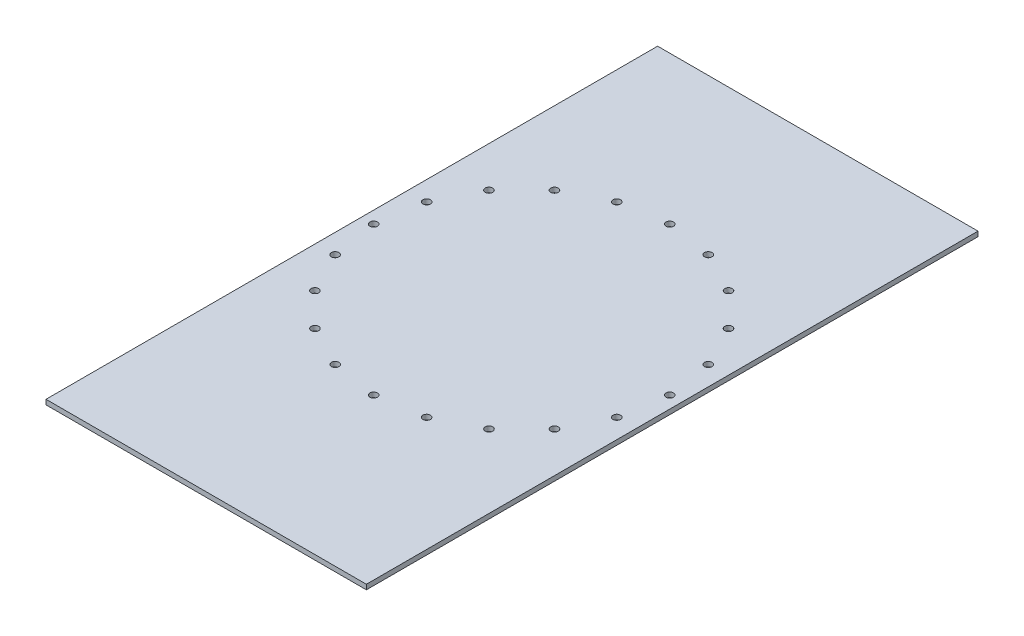
from build123d import *

# Parameters (mm, degrees)
ESQUISSE1_W             = 660
ESQUISSE1_H             = 1260
BOSS_EXTRU_1_DEPTH      = 10
ESQUISSE2_R             = 7.75
ENL_V_MAT_EXTRU_1_DEPTH = 10


with BuildPart() as part:
    # Esquisse1 → Boss.-Extru.1 (new body)
    with BuildSketch(Plane(origin=(0, 0, 0), x_dir=(1, 0, 0), z_dir=(0, 1, 0))):
        with Locations((330, 630)):
            Rectangle(ESQUISSE1_W, ESQUISSE1_H)
    extrude(amount=BOSS_EXTRU_1_DEPTH)

    # Esquisse2 → Enlèv. mat.-Extru.1 (cut)
    with BuildSketch(Plane(origin=(0, 10, 0), x_dir=(1, 0, 0), z_dir=(0, 1, 0))):
        with Locations(Location((25, 650, 0), (0, 0, 270))):
            Circle(ESQUISSE2_R)
        with Locations(Location((39.92776253, 744.250183284, 0), (0, 0, 270))):
            Circle(ESQUISSE2_R)
        with Locations(Location((83.249816716, 829.274501949, 0), (0, 0, 270))):
            Circle(ESQUISSE2_R)
        with Locations(Location((150.725498051, 896.750183284, 0), (0, 0, 270))):
            Circle(ESQUISSE2_R)
        with Locations(Location((235.749816716, 940.07223747, 0), (0, 0, 270))):
            Circle(ESQUISSE2_R)
        with Locations(Location((330, 955, 0), (0, 0, 270))):
            Circle(ESQUISSE2_R)
        with Locations(Location((424.250183284, 940.07223747, 0), (0, 0, 270))):
            Circle(ESQUISSE2_R)
        with Locations(Location((509.274501949, 896.750183284, 0), (0, 0, 270))):
            Circle(ESQUISSE2_R)
        with Locations(Location((576.750183284, 829.274501949, 0), (0, 0, 270))):
            Circle(ESQUISSE2_R)
        with Locations(Location((620.07223747, 744.250183284, 0), (0, 0, 270))):
            Circle(ESQUISSE2_R)
        with Locations(Location((635, 650, 0), (0, 0, 270))):
            Circle(ESQUISSE2_R)
        with Locations(Location((620.07223747, 555.749816716, 0), (0, 0, 270))):
            Circle(ESQUISSE2_R)
        with Locations(Location((576.750183284, 470.725498051, 0), (0, 0, 270))):
            Circle(ESQUISSE2_R)
        with Locations(Location((509.274501949, 403.249816716, 0), (0, 0, 270))):
            Circle(ESQUISSE2_R)
        with Locations(Location((424.250183284, 359.92776253, 0), (0, 0, 270))):
            Circle(ESQUISSE2_R)
        with Locations(Location((330, 345, 0), (0, 0, 270))):
            Circle(ESQUISSE2_R)
        with Locations(Location((235.749816716, 359.92776253, 0), (0, 0, 270))):
            Circle(ESQUISSE2_R)
        with Locations(Location((150.725498051, 403.249816716, 0), (0, 0, 270))):
            Circle(ESQUISSE2_R)
        with Locations(Location((83.249816716, 470.725498051, 0), (0, 0, 270))):
            Circle(ESQUISSE2_R)
        with Locations(Location((39.92776253, 555.749816716, 0), (0, 0, 270))):
            Circle(ESQUISSE2_R)
    extrude(amount=-ENL_V_MAT_EXTRU_1_DEPTH, mode=Mode.SUBTRACT)


solid = part.part
